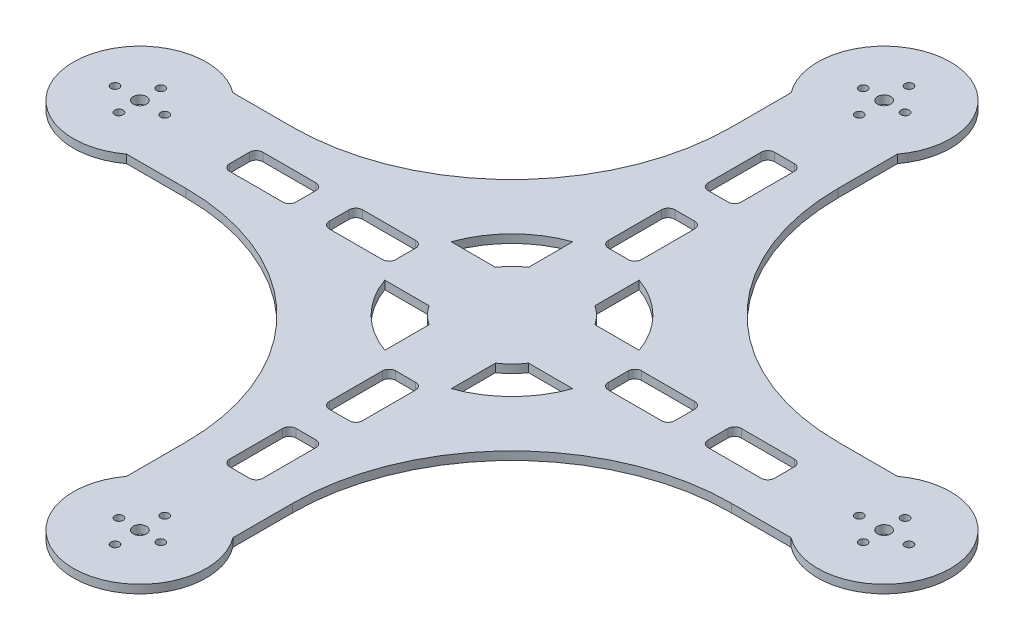
from build123d import *

# Parameters (mm, degrees)
SKETCH1_R           = 1.5875
SKETCH1_R_2         = 2.54
BOSS_EXTRUDE1_DEPTH = 3.175


with BuildPart() as part:
    # Sketch1 → Boss-Extrude1 (new body)
    with BuildSketch(Plane(origin=(0, 0, 0), x_dir=(1, 0, 0), z_dir=(0, 1, 0))):
        with BuildLine():
            ThreePointArc((106.34156313, 17.784127356), (65.70156313, -2.535872644), (106.34156313, -22.855872644))
            Line((106.34156313, -22.855872644), (129.095821507, -22.855872644))
            ThreePointArc((129.095821507, -22.855872644), (188.440282525, -47.437153249), (213.02156313, -106.781614267))
            Line((213.02156313, -106.781614267), (213.02156313, -129.535872644))
            ThreePointArc((213.02156313, -129.535872644), (233.34156313, -170.175872644), (253.66156313, -129.535872644))
            Line((253.66156313, -129.535872644), (253.66156313, -106.781614267))
            ThreePointArc((253.66156313, -106.781614267), (278.242843735, -47.437153249), (337.587304753, -22.855872644))
            Line((337.587304753, -22.855872644), (360.34156313, -22.855872644))
            ThreePointArc((360.34156313, -22.855872644), (400.98156313, -2.535872644), (360.34156313, 17.784127356))
            Line((360.34156313, 17.784127356), (337.587304753, 17.784127356))
            ThreePointArc((337.587304753, 17.784127356), (278.242843735, 42.365407962), (253.66156313, 101.70986898))
            Line((253.66156313, 101.70986898), (253.66156313, 124.464127356))
            ThreePointArc((253.66156313, 124.464127356), (233.34156313, 165.104127356), (213.02156313, 124.464127356))
            Line((213.02156313, 124.464127356), (213.02156313, 101.70986898))
            ThreePointArc((213.02156313, 101.70986898), (188.440282525, 42.365407962), (129.095821507, 17.784127356))
            Line((129.095821507, 17.784127356), (106.34156313, 17.784127356))
        make_face()
        with BuildLine():
            ThreePointArc((276.52156313, -8.885872644), (274.725511906, -8.141923868), (273.98156313, -6.345872644))
            Line((273.98156313, -6.345872644), (273.98156313, 1.274127356))
            ThreePointArc((273.98156313, 1.274127356), (274.725511906, 3.07017858), (276.52156313, 3.814127356))
            Line((276.52156313, 3.814127356), (296.84156313, 3.814127356))
            ThreePointArc((296.84156313, 3.814127356), (298.637614354, 3.07017858), (299.38156313, 1.274127356))
            Line((299.38156313, 1.274127356), (299.38156313, -6.345872644))
            ThreePointArc((299.38156313, -6.345872644), (298.637614354, -8.141923868), (296.84156313, -8.885872644))
            Line((296.84156313, -8.885872644), (276.52156313, -8.885872644))
        make_face(mode=Mode.SUBTRACT)
        with BuildLine():
            ThreePointArc((239.69156313, -66.035872644), (238.947614354, -67.831923868), (237.15156313, -68.575872644))
            Line((237.15156313, -68.575872644), (229.53156313, -68.575872644))
            ThreePointArc((229.53156313, -68.575872644), (227.735511906, -67.831923868), (226.99156313, -66.035872644))
            Line((226.99156313, -66.035872644), (226.99156313, -45.715872644))
            ThreePointArc((226.99156313, -45.715872644), (227.735511906, -43.91982142), (229.53156313, -43.175872644))
            Line((229.53156313, -43.175872644), (237.15156313, -43.175872644))
            ThreePointArc((237.15156313, -43.175872644), (238.947614354, -43.91982142), (239.69156313, -45.715872644))
            Line((239.69156313, -45.715872644), (239.69156313, -66.035872644))
        make_face(mode=Mode.SUBTRACT)
        with BuildLine():
            ThreePointArc((239.69156313, 40.644127356), (238.947614354, 38.848076132), (237.15156313, 38.104127356))
            Line((237.15156313, 38.104127356), (229.53156313, 38.104127356))
            ThreePointArc((229.53156313, 38.104127356), (227.735511906, 38.848076132), (226.99156313, 40.644127356))
            Line((226.99156313, 40.644127356), (226.99156313, 60.964127356))
            ThreePointArc((226.99156313, 60.964127356), (227.735511906, 62.76017858), (229.53156313, 63.504127356))
            Line((229.53156313, 63.504127356), (237.15156313, 63.504127356))
            ThreePointArc((237.15156313, 63.504127356), (238.947614354, 62.76017858), (239.69156313, 60.964127356))
            Line((239.69156313, 60.964127356), (239.69156313, 40.644127356))
        make_face(mode=Mode.SUBTRACT)
        with BuildLine():
            ThreePointArc((169.84156313, -8.885872644), (168.045511906, -8.141923868), (167.30156313, -6.345872644))
            Line((167.30156313, -6.345872644), (167.30156313, 1.274127356))
            ThreePointArc((167.30156313, 1.274127356), (168.045511906, 3.07017858), (169.84156313, 3.814127356))
            Line((169.84156313, 3.814127356), (190.16156313, 3.814127356))
            ThreePointArc((190.16156313, 3.814127356), (191.957614354, 3.07017858), (192.70156313, 1.274127356))
            Line((192.70156313, 1.274127356), (192.70156313, -6.345872644))
            ThreePointArc((192.70156313, -6.345872644), (191.957614354, -8.141923868), (190.16156313, -8.885872644))
            Line((190.16156313, -8.885872644), (169.84156313, -8.885872644))
        make_face(mode=Mode.SUBTRACT)
        with BuildLine():
            ThreePointArc((129.20156313, 1.274127356), (129.945511906, 3.07017858), (131.74156313, 3.814127356))
            Line((131.74156313, 3.814127356), (152.06156313, 3.814127356))
            ThreePointArc((152.06156313, 3.814127356), (153.857614354, 3.07017858), (154.60156313, 1.274127356))
            Line((154.60156313, 1.274127356), (154.60156313, -6.345872644))
            ThreePointArc((154.60156313, -6.345872644), (153.857614354, -8.141923868), (152.06156313, -8.885872644))
            Line((152.06156313, -8.885872644), (131.74156313, -8.885872644))
            ThreePointArc((131.74156313, -8.885872644), (129.945511906, -8.141923868), (129.20156313, -6.345872644))
            Line((129.20156313, -6.345872644), (129.20156313, 1.274127356))
        make_face(mode=Mode.SUBTRACT)
        with Locations(Location((91.10156313, 5.464127356, 0), (0, 0, 270))):
            Circle(SKETCH1_R, mode=Mode.SUBTRACT)
        with Locations(Location((100.60156313, -2.535872644, 0), (0, 0, 270))):
            Circle(SKETCH1_R, mode=Mode.SUBTRACT)
        with Locations(Location((91.10156313, -10.535872644, 0), (0, 0, 270))):
            Circle(SKETCH1_R, mode=Mode.SUBTRACT)
        with Locations(Location((91.10156313, -2.535872644, 0), (0, 0, 270))):
            Circle(SKETCH1_R_2, mode=Mode.SUBTRACT)
        with Locations(Location((81.60156313, -2.535872644, 0), (0, 0, 270))):
            Circle(SKETCH1_R, mode=Mode.SUBTRACT)
        with BuildLine():
            ThreePointArc((220.64156313, -38.456897128), (206.400794767, -29.476641007), (197.420538646, -15.235872644))
            Line((197.420538646, -15.235872644), (214.333943605, -15.235872644))
            ThreePointArc((214.333943605, -15.235872644), (217.177102112, -18.700333662), (220.64156313, -21.543492169))
            Line((220.64156313, -21.543492169), (220.64156313, -38.456897128))
        make_face(mode=Mode.SUBTRACT)
        with BuildLine():
            ThreePointArc((197.420538646, 10.164127356), (206.400794767, 24.404895719), (220.64156313, 33.385151841))
            Line((220.64156313, 33.385151841), (220.64156313, 16.471746881))
            ThreePointArc((220.64156313, 16.471746881), (217.177102112, 13.628588374), (214.333943605, 10.164127356))
            Line((214.333943605, 10.164127356), (197.420538646, 10.164127356))
        make_face(mode=Mode.SUBTRACT)
        with BuildLine():
            ThreePointArc((246.04156313, 33.385151841), (260.282331493, 24.404895719), (269.262587614, 10.164127356))
            Line((269.262587614, 10.164127356), (252.349182655, 10.164127356))
            ThreePointArc((252.349182655, 10.164127356), (249.506024148, 13.628588374), (246.04156313, 16.471746881))
            Line((246.04156313, 16.471746881), (246.04156313, 33.385151841))
        make_face(mode=Mode.SUBTRACT)
        with BuildLine():
            ThreePointArc((269.262587614, -15.235872644), (260.282331493, -29.476641007), (246.04156313, -38.456897128))
            Line((246.04156313, -38.456897128), (246.04156313, -21.543492169))
            ThreePointArc((246.04156313, -21.543492169), (249.506024148, -18.700333662), (252.349182655, -15.235872644))
            Line((252.349182655, -15.235872644), (269.262587614, -15.235872644))
        make_face(mode=Mode.SUBTRACT)
        with BuildLine():
            ThreePointArc((229.53156313, 76.204127356), (227.735511906, 76.948076132), (226.99156313, 78.744127356))
            Line((226.99156313, 78.744127356), (226.99156313, 99.064127356))
            ThreePointArc((226.99156313, 99.064127356), (227.735511906, 100.86017858), (229.53156313, 101.604127356))
            Line((229.53156313, 101.604127356), (237.15156313, 101.604127356))
            ThreePointArc((237.15156313, 101.604127356), (238.947614354, 100.86017858), (239.69156313, 99.064127356))
            Line((239.69156313, 99.064127356), (239.69156313, 78.744127356))
            ThreePointArc((239.69156313, 78.744127356), (238.947614354, 76.948076132), (237.15156313, 76.204127356))
            Line((237.15156313, 76.204127356), (229.53156313, 76.204127356))
        make_face(mode=Mode.SUBTRACT)
        with Locations(Location((233.34156313, 149.204127356, 0), (0, 0, 270))):
            Circle(SKETCH1_R, mode=Mode.SUBTRACT)
        with Locations(Location((225.34156313, 139.704127356, 0), (0, 0, 270))):
            Circle(SKETCH1_R, mode=Mode.SUBTRACT)
        with Locations(Location((233.34156313, 130.204127356, 0), (0, 0, 270))):
            Circle(SKETCH1_R, mode=Mode.SUBTRACT)
        with Locations(Location((233.34156313, 139.704127356, 0), (0, 0, 270))):
            Circle(SKETCH1_R_2, mode=Mode.SUBTRACT)
        with Locations(Location((241.34156313, 139.704127356, 0), (0, 0, 270))):
            Circle(SKETCH1_R, mode=Mode.SUBTRACT)
        with BuildLine():
            ThreePointArc((237.15156313, -81.275872644), (238.947614354, -82.01982142), (239.69156313, -83.815872644))
            Line((239.69156313, -83.815872644), (239.69156313, -104.135872644))
            ThreePointArc((239.69156313, -104.135872644), (238.947614354, -105.931923868), (237.15156313, -106.675872644))
            Line((237.15156313, -106.675872644), (229.53156313, -106.675872644))
            ThreePointArc((229.53156313, -106.675872644), (227.735511906, -105.931923868), (226.99156313, -104.135872644))
            Line((226.99156313, -104.135872644), (226.99156313, -83.815872644))
            ThreePointArc((226.99156313, -83.815872644), (227.735511906, -82.01982142), (229.53156313, -81.275872644))
            Line((229.53156313, -81.275872644), (237.15156313, -81.275872644))
        make_face(mode=Mode.SUBTRACT)
        with Locations(Location((233.34156313, -135.275872644, 0), (0, 0, 270))):
            Circle(SKETCH1_R, mode=Mode.SUBTRACT)
        with Locations(Location((225.34156313, -144.775872644, 0), (0, 0, 270))):
            Circle(SKETCH1_R, mode=Mode.SUBTRACT)
        with Locations(Location((233.34156313, -154.275872644, 0), (0, 0, 270))):
            Circle(SKETCH1_R, mode=Mode.SUBTRACT)
        with Locations(Location((233.34156313, -144.775872644, 0), (0, 0, 270))):
            Circle(SKETCH1_R_2, mode=Mode.SUBTRACT)
        with Locations(Location((241.34156313, -144.775872644, 0), (0, 0, 270))):
            Circle(SKETCH1_R, mode=Mode.SUBTRACT)
        with BuildLine():
            Line((334.94156313, -8.885872644), (314.62156313, -8.885872644))
            ThreePointArc((314.62156313, -8.885872644), (312.825511906, -8.141923868), (312.08156313, -6.345872644))
            Line((312.08156313, -6.345872644), (312.08156313, 1.274127356))
            ThreePointArc((312.08156313, 1.274127356), (312.825511906, 3.07017858), (314.62156313, 3.814127356))
            Line((314.62156313, 3.814127356), (334.94156313, 3.814127356))
            ThreePointArc((334.94156313, 3.814127356), (336.737614354, 3.07017858), (337.48156313, 1.274127356))
            Line((337.48156313, 1.274127356), (337.48156313, -6.345872644))
            ThreePointArc((337.48156313, -6.345872644), (336.737614354, -8.141923868), (334.94156313, -8.885872644))
        make_face(mode=Mode.SUBTRACT)
        with Locations(Location((385.08156313, -2.535872644, 0), (0, 0, 270))):
            Circle(SKETCH1_R, mode=Mode.SUBTRACT)
        with Locations(Location((375.58156313, -10.535872644, 0), (0, 0, 270))):
            Circle(SKETCH1_R, mode=Mode.SUBTRACT)
        with Locations(Location((375.58156313, -2.535872644, 0), (0, 0, 270))):
            Circle(SKETCH1_R_2, mode=Mode.SUBTRACT)
        with Locations(Location((366.08156313, -2.535872644, 0), (0, 0, 270))):
            Circle(SKETCH1_R, mode=Mode.SUBTRACT)
        with Locations(Location((375.58156313, 5.464127356, 0), (0, 0, 270))):
            Circle(SKETCH1_R, mode=Mode.SUBTRACT)
    extrude(amount=BOSS_EXTRUDE1_DEPTH)


solid = part.part
